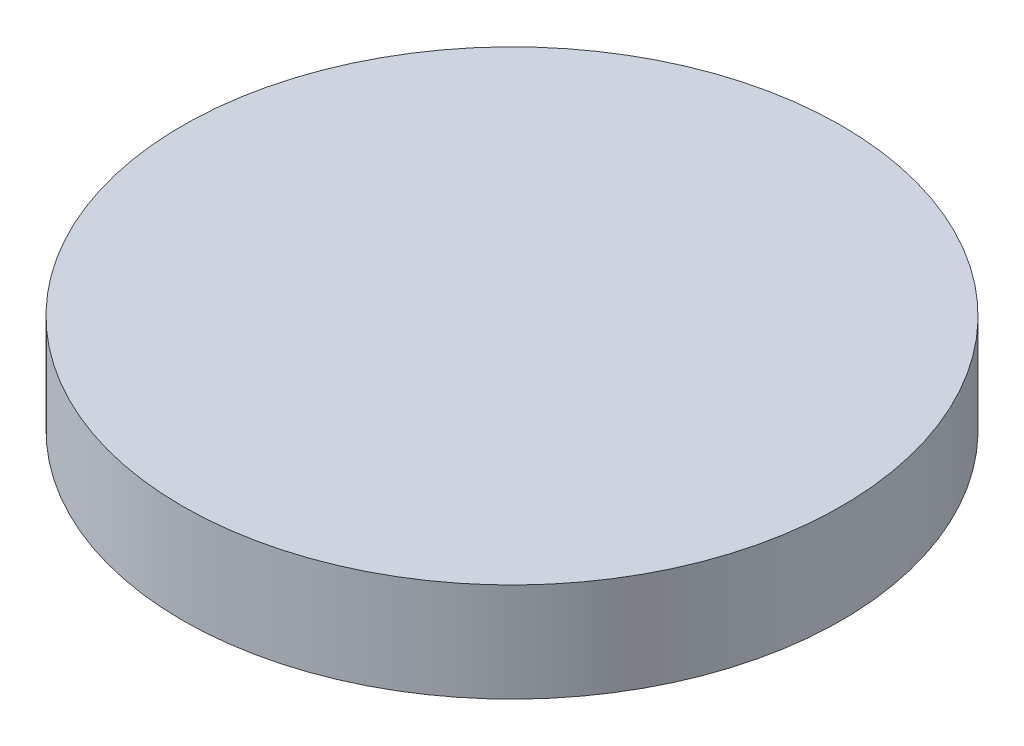
from build123d import *

# Parameters (mm, degrees)
SKETCH1_R           = 25.4
BOSS_EXTRUDE2_DEPTH = 7.62
SKETCH4_R           = 4.826
CUT_EXTRUDE2_DEPTH  = 3.048
CIRPATTERN1_COUNT   = 6
SKETCH5_R           = 4.826
CUT_EXTRUDE6_DEPTH  = 3.048
SKETCH7_R           = 0.79375
CUT_EXTRUDE7_DEPTH  = 1.5875


with BuildPart() as part:
    # Sketch1 → Boss-Extrude2 (new body)
    with BuildSketch(Plane(origin=(0, 0, 0), x_dir=(1, 0, 0), z_dir=(0, 1, 0))):
        with Locations(Location((0, 0, 0), (0, 0, 270))):
            Circle(SKETCH1_R)
    extrude(amount=BOSS_EXTRUDE2_DEPTH)

    # Sketch4 → Cut-Extrude2 (cut)
    with BuildSketch(Plane(origin=(0, 0, 0), x_dir=(1, 0, 0), z_dir=(0, 1, 0))):
        with Locations(Location((0, 17.78, 0), (0, 0, 90))):
            Circle(SKETCH4_R)
    cut_extrude2 = extrude(amount=CUT_EXTRUDE2_DEPTH, mode=Mode.SUBTRACT)

    # CirPattern1: Cut-Extrude2 ×6 about axis
    cirpattern1_axis = Axis((0, 0, 0), (0, 1, 0))
    for i in range(1, CIRPATTERN1_COUNT):
        add(cut_extrude2.rotate(cirpattern1_axis, i * 360 / CIRPATTERN1_COUNT), mode=Mode.SUBTRACT)

    # Sketch5 → Cut-Extrude6 (cut)
    with BuildSketch(Plane(origin=(0, 0, 0), x_dir=(1, 0, 0), z_dir=(0, 1, 0))):
        with Locations(Location((0, 0, 0), (0, 0, 90))):
            Circle(SKETCH5_R)
    extrude(amount=CUT_EXTRUDE6_DEPTH, mode=Mode.SUBTRACT)

    # Sketch7 → Cut-Extrude7 (cut)
    with BuildSketch(Plane.XZ):
        with Locations(Location((4.532486744, 7.647788172, 0), (0, 0, 270))):
            Circle(SKETCH7_R)
        with Locations(Location((4.356935467, -7.749142748, 0), (0, 0, 270))):
            Circle(SKETCH7_R)
        with Locations(Location((-8.889422211, 0.101354577, 0), (0, 0, 270))):
            Circle(SKETCH7_R)
    extrude(amount=-CUT_EXTRUDE7_DEPTH, mode=Mode.SUBTRACT)


solid = part.part
